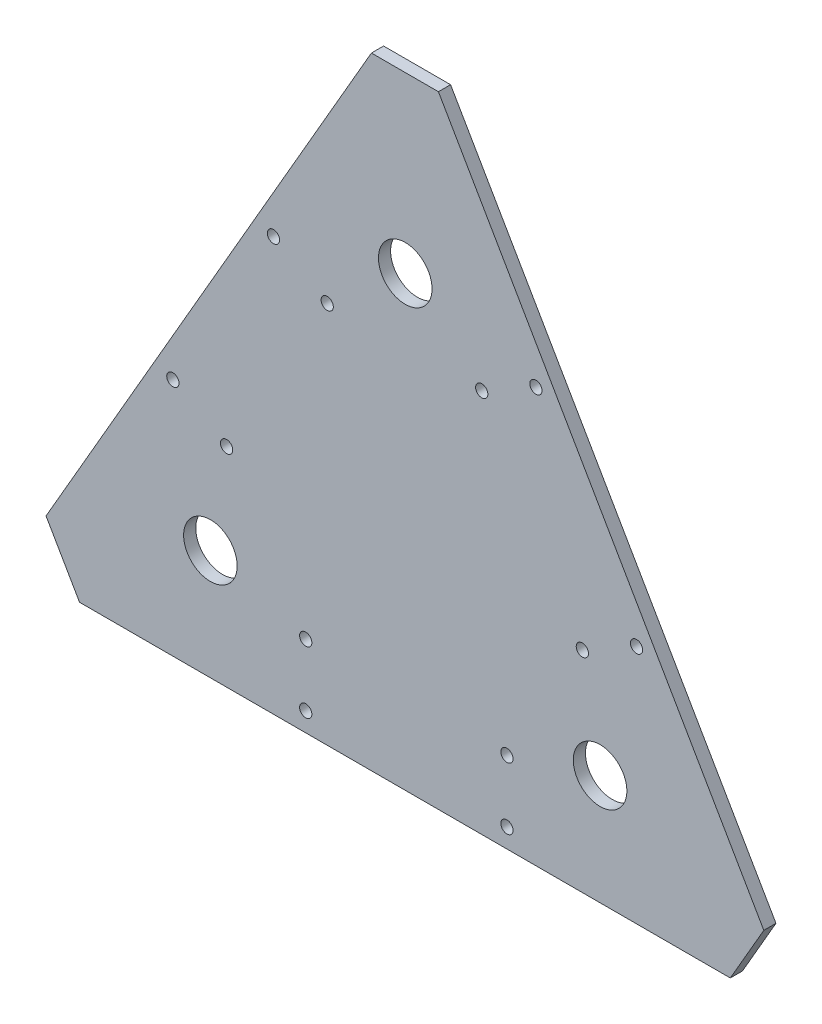
from build123d import *

# Parameters (mm, degrees)
SKETCH1_R           = 3.2
SKETCH1_R_2         = 14
BOSS_EXTRUDE1_DEPTH = 6.35


with BuildPart() as part:
    # Sketch1 → Boss-Extrude1 (new body)
    with BuildSketch(Plane.XY):
        Polygon((-647.460250444, -317.619540534), (-477.475995614, -23.198174681), (-442.475995614, -23.198174681), (-272.491740783, -317.619540534), (-289.991740783, -347.930429667), (-629.960250444, -347.930429667), align=None)
        with Locations((-581.209182953, -222.869325584)):
            Circle(SKETCH1_R, mode=Mode.SUBTRACT)
        with Locations((-528.649182953, -131.832735139)):
            Circle(SKETCH1_R, mode=Mode.SUBTRACT)
        with Locations((-500.577727615, -148.011529753)):
            Circle(SKETCH1_R, mode=Mode.SUBTRACT)
        with Locations((-553.136815613, -239.046537702)):
            Circle(SKETCH1_R, mode=Mode.SUBTRACT)
        with Locations((-367.294158494, -238.209054553)):
            Circle(SKETCH1_R, mode=Mode.SUBTRACT)
        with Locations((-419.854158494, -147.172464107)):
            Circle(SKETCH1_R, mode=Mode.SUBTRACT)
        with Locations((-391.545684719, -131.412060795)):
            Circle(SKETCH1_R, mode=Mode.SUBTRACT)
        with Locations((-338.985684719, -222.448651241)):
            Circle(SKETCH1_R, mode=Mode.SUBTRACT)
        with Locations((-511.800751787, -305.530429667)):
            Circle(SKETCH1_R, mode=Mode.SUBTRACT)
        with Locations((-406.680508256, -305.530429667)):
            Circle(SKETCH1_R, mode=Mode.SUBTRACT)
        with Locations((-406.680630022, -337.930429667)):
            Circle(SKETCH1_R, mode=Mode.SUBTRACT)
        with Locations((-511.800630022, -337.930429667)):
            Circle(SKETCH1_R, mode=Mode.SUBTRACT)
        with Locations((-459.807870528, -114.054080446)):
            Circle(SKETCH1_R_2, mode=Mode.SUBTRACT)
        with Locations((-358.022290508, -290.351876517)):
            Circle(SKETCH1_R_2, mode=Mode.SUBTRACT)
        with Locations((-561.593450547, -290.351876517)):
            Circle(SKETCH1_R_2, mode=Mode.SUBTRACT)
    extrude(amount=-BOSS_EXTRUDE1_DEPTH)


solid = part.part
